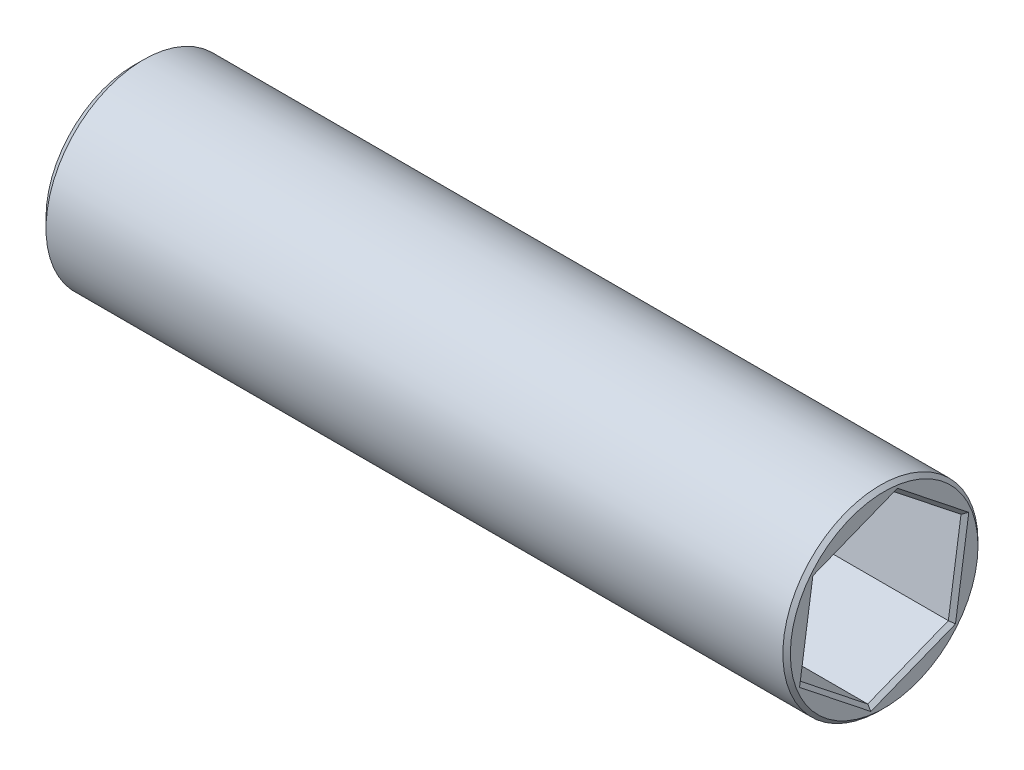
from build123d import *

# Parameters (mm, degrees)
SKETCH1_R           = 3.9
SKETCH1_R_2         = 1.575
BOSS_EXTRUDE1_DEPTH = 30
CUT_EXTRUDE1_DEPTH  = 25
CHAMFER1_SIZE       = 0.4
CHAMFER2_SIZE       = 0.15


with BuildPart() as part:
    # Sketch1 → Boss-Extrude1 (new body)
    with BuildSketch(Plane(origin=(0, 0, 0), x_dir=(0, 0, -1), z_dir=(1, 0, 0))):
        Circle(SKETCH1_R)
        Circle(SKETCH1_R_2, mode=Mode.SUBTRACT)
    extrude(amount=BOSS_EXTRUDE1_DEPTH)

    # Sketch2 → Cut-Extrude1 (cut)
    with BuildSketch(Plane(origin=(30, 0, 0), x_dir=(0, 0, -1), z_dir=(1, 0, 0))):
        Polygon((0.506657863, 3.426849546), (-2.71440983, 2.152203353), (-3.221067693, -1.274646193), (-0.506657863, -3.426849546), (2.71440983, -2.152203353), (3.221067693, 1.274646193), align=None)
    extrude(amount=-CUT_EXTRUDE1_DEPTH, mode=Mode.SUBTRACT)

    # Chamfer1
    chamfer1_edges = [part.edges().sort_by_distance(p)[0] for p in [
        (0, 0, 3.9),
        (0, 0, 1.575),
    ]]
    chamfer(chamfer1_edges, length=CHAMFER1_SIZE)

    # Chamfer2
    chamfer2_edges = [part.edges().sort_by_distance(p)[0] for p in [
        (30, 2.350747869, -1.863862778),
        (30, 2.78952645, 1.103875984),
        (30, 0.43877858, 2.967738762),
        (30, -2.350747869, 1.863862778),
        (30, -2.78952645, -1.103875984),
        (30, -0.43877858, -2.967738762),
        (30, 0, 3.9),
    ]]
    chamfer(chamfer2_edges, length=CHAMFER2_SIZE)


solid = part.part
